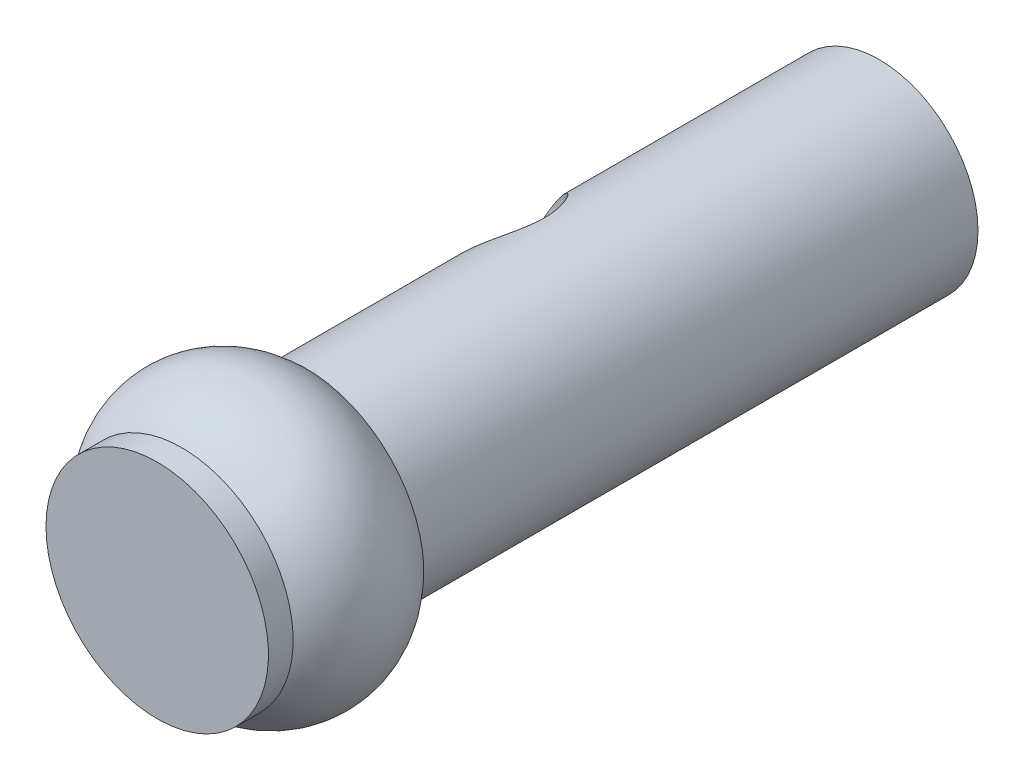
from build123d import *

# Parameters (mm, degrees)
TROU_DE_PASSAGE_D_AXE_3_321_REACH  = 43.97
TROU_DE_PASSAGE_D_AXE_3_321_BORE_R = 4.5


with BuildPart() as part:
    # Esquisse2 → Révolution1 (revolve)
    with BuildSketch(Plane(origin=(0, 0, 0), x_dir=(1, 0, 0), z_dir=(0, 1, 0)), mode=Mode.PRIVATE) as r_volution1_sk:
        with BuildLine():
            Line((7, 43.342725136), (7, -3.004612909))
            Line((7, -3.004612909), (0, -3.004612909))
            Line((0, -3.004612909), (0, -12.657274864))
            Line((0, -12.657274864), (0, -15.078606198))
            Line((0, -15.078606198), (9, -15.078606198))
            Line((9, -15.078606198), (9, -13.078606198))
            ThreePointArc((9, -13.078606198), (11.39286281, -8.14796573), (9.5, -3.004612909))
            Line((9.5, -3.004612909), (8, -3.004612909))
            Line((8, -3.004612909), (8, 43.342725136))
            Line((8, 43.342725136), (7, 43.342725136))
        make_face()
    revolve(r_volution1_sk.sketch.rotate(Axis((0, 0, -12.780225136), (0, 0, 1)), 180), axis=Axis((0, 0, -12.780225136), (0, 0, 1)))

    # Trou de passage d'axe 3/321 bore (on position points) → Trou de passage d'axe 3/321 (cut, up to next)
    with BuildSketch(Plane(origin=(-6.681517016, 4.399696622, -19.342725136), x_dir=(-0.549962077733, -0.835189627005, 0), z_dir=(-0.835189627005, 0.549962077733, 0)), mode=Mode.PRIVATE) as trou_de_passage_d_axe_3_321_sk1:
        Circle(TROU_DE_PASSAGE_D_AXE_3_321_BORE_R)
    trou_de_passage_d_axe_3_321_tool1 = extrude(trou_de_passage_d_axe_3_321_sk1.sketch, amount=-TROU_DE_PASSAGE_D_AXE_3_321_REACH, mode=Mode.PRIVATE) & part.part
    add(trou_de_passage_d_axe_3_321_tool1.solids().sort_by_distance((-6.681517, 4.399697, -19.342725))[0], mode=Mode.SUBTRACT)


solid = part.part
